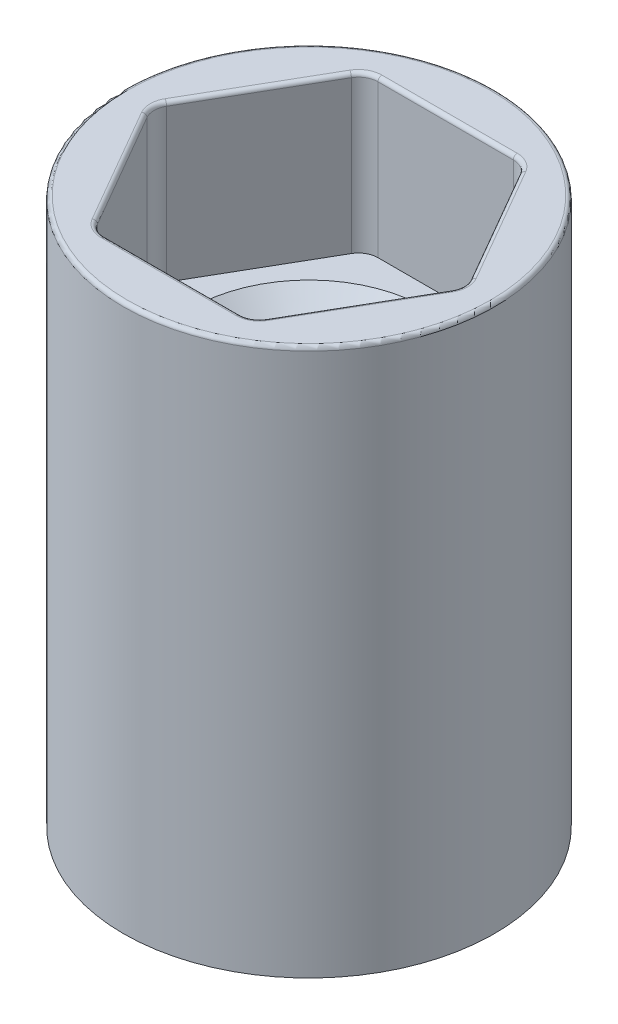
from build123d import *

# Parameters (mm, degrees)
SKETCH1_R           = 4.75
SKETCH1_R_2         = 2.5
BOSS_EXTRUDE1_DEPTH = 14
CUT_EXTRUDE1_DEPTH  = 4
FILLET1_R           = 0.5
CHAMFER1_SIZE       = 0.5
FILLET2_R           = 0.1


with BuildPart() as part:
    # Sketch1 → Boss-Extrude1 (new body)
    with BuildSketch(Plane(origin=(0, 0, 0), x_dir=(1, 0, 0), z_dir=(0, 1, 0))):
        with Locations(Location((0, 0, 0), (0, 0, 270))):
            Circle(SKETCH1_R)
        with Locations(Location((0, 0, 0), (0, 0, 270))):
            Circle(SKETCH1_R_2, mode=Mode.SUBTRACT)
    extrude(amount=BOSS_EXTRUDE1_DEPTH)

    # Sketch2 → Cut-Extrude1 (cut)
    with BuildSketch(Plane(origin=(0, 14, 0), x_dir=(1, 0, 0), z_dir=(0, 1, 0))):
        Polygon((4.041451884, 0), (2.020725942, 3.5), (-2.020725942, 3.5), (-4.041451884, 0), (-2.020725942, -3.5), (2.020725942, -3.5), align=None)
    extrude(amount=-CUT_EXTRUDE1_DEPTH, mode=Mode.SUBTRACT)

    # Fillet1
    fillet1_edges = [part.edges().sort_by_distance(p)[0] for p in [
        (4.041451884, 12, 0),
        (2.020725942, 12, 3.5),
        (-2.020725942, 12, 3.5),
        (-4.041451884, 12, 0),
        (-2.020725942, 12, -3.5),
        (2.020725942, 12, -3.5),
    ]]
    fillet(fillet1_edges, radius=FILLET1_R)

    # Chamfer1
    chamfer1_edges = [part.edges().sort_by_distance(p)[0] for p in [
        (0, 10, -2.5),
        (0, 0, -2.5),
    ]]
    chamfer(chamfer1_edges, length=CHAMFER1_SIZE)

    # Fillet2
    fillet2_edges = [part.edges().sort_by_distance(p)[0] for p in [
        (3.031088913, 14, 1.75),
        (0, 14, 3.5),
        (-3.031088913, 14, 1.75),
        (0, 14, -4.75),
        (-3.031088913, 14, -1.75),
        (3.031088913, 14, -1.75),
        (0, 14, -3.5),
        (1.982050808, 14, 3.433012702),
        (-1.982050808, 14, 3.433012702),
        (-3.964101615, 14, 0),
        (3.964101615, 14, 0),
        (1.982050808, 14, -3.433012702),
        (-1.982050808, 14, -3.433012702),
    ]]
    fillet(fillet2_edges, radius=FILLET2_R)


solid = part.part
